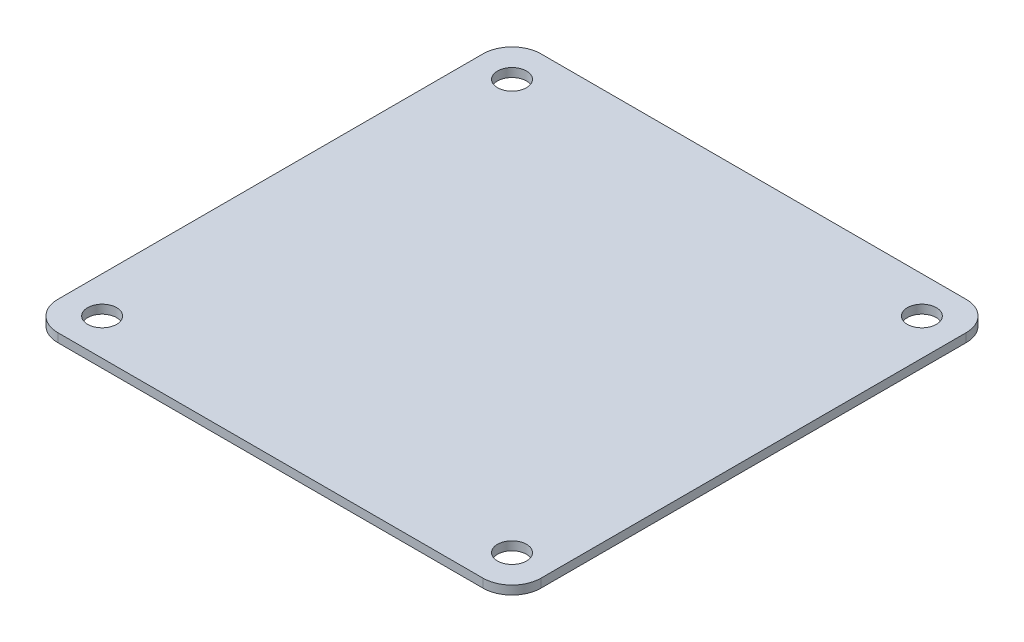
from build123d import *

# Parameters (mm, degrees)
SKETCH2_W           = 100
SKETCH2_H           = 100
SKETCH2_R           = 3
BOSS_EXTRUDE1_DEPTH = 1.8
FILLET1_R           = 6
SKETCH3_R           = 42
SKETCH3_R_2         = 40
BOSS_EXTRUDE2_DEPTH = 3


with BuildPart() as part:
    # Sketch2 → Boss-Extrude1 (new body)
    with BuildSketch(Plane(origin=(0, 0, 0), x_dir=(1, 0, 0), z_dir=(0, 1, 0))):
        Rectangle(SKETCH2_W, SKETCH2_H)
        with Locations(Location((-42.425, 42.425, 0), (0, 0, 270))):
            Circle(SKETCH2_R, mode=Mode.SUBTRACT)
        with Locations(Location((42.425, 42.425, 0), (0, 0, 270))):
            Circle(SKETCH2_R, mode=Mode.SUBTRACT)
        with Locations(Location((42.425, -42.425, 0), (0, 0, 270))):
            Circle(SKETCH2_R, mode=Mode.SUBTRACT)
        with Locations(Location((-42.425, -42.425, 0), (0, 0, 270))):
            Circle(SKETCH2_R, mode=Mode.SUBTRACT)
    extrude(amount=BOSS_EXTRUDE1_DEPTH)

    # Fillet1
    fillet1_edges = [part.edges().sort_by_distance(p)[0] for p in [
        (50, 0.9, 50),
        (-50, 0.9, 50),
        (-50, 0.9, -50),
        (50, 0.9, -50),
    ]]
    fillet(fillet1_edges, radius=FILLET1_R)

    # Sketch3 → Boss-Extrude2 (add)
    with BuildSketch(Plane.XZ):
        with Locations(Location((0, 0, 0), (0, 0, 90))):
            Circle(SKETCH3_R)
        with Locations(Location((0, 0, 0), (0, 0, 270))):
            Circle(SKETCH3_R_2, mode=Mode.SUBTRACT)
    extrude(amount=BOSS_EXTRUDE2_DEPTH)


solid = part.part
